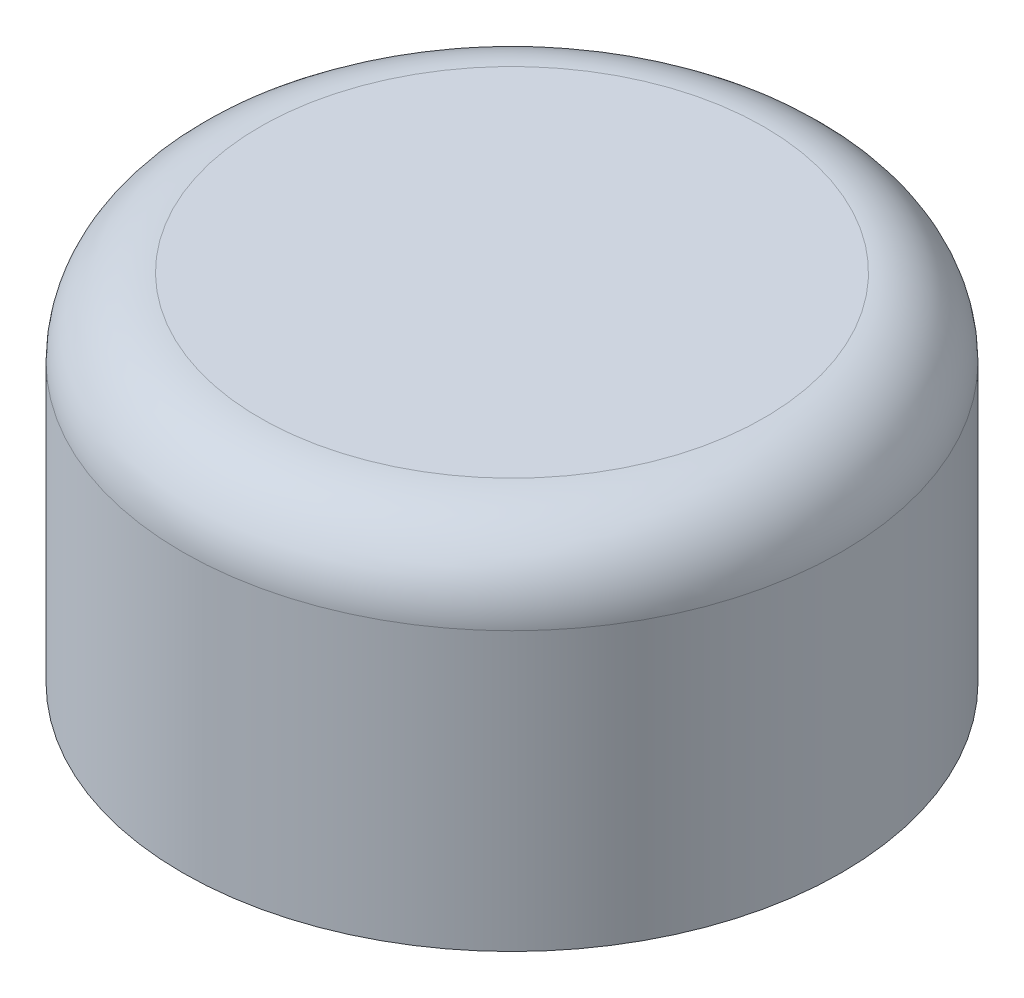
from build123d import *

# Parameters (mm, degrees)
SKETCH1_R           = 37.85
BOSS_EXTRUDE1_DEPTH = 19.4
SKETCH4_R           = 1.5
CUT_EXTRUDE1_DEPTH  = 1


with BuildPart() as part:
    # Sketch1 → Boss-Extrude1 (new body)
    with BuildSketch(Plane(origin=(0, 0, 0), x_dir=(1, 0, 0), z_dir=(0, 1, 0))):
        with Locations(Location((0, 0, 0), (0, 0, 270))):
            Circle(SKETCH1_R)
    extrude(amount=BOSS_EXTRUDE1_DEPTH)

    # Sketch3 → Revolve1 (revolve)
    with BuildSketch(Plane(origin=(0, 0, 0), x_dir=(0, 0, -1), z_dir=(1, 0, 0))):
        with BuildLine():
            Line((37.85, 19.4), (37.85, 30.8))
            Line((37.85, 30.8), (37.85, 31.91000006))
            ThreePointArc((37.85, 31.91000006), (35.246179285, 38.196179345), (28.96, 40.80000006))
            Line((28.96, 40.80000006), (0, 40.80000006))
            Line((0, 40.80000006), (0, 19.4))
            Line((0, 19.4), (37.85, 19.4))
        make_face()
    revolve(axis=Axis((0, 19.4, 0), (0, 1, 0)))

    # Sketch4 → Cut-Extrude1 (cut)
    with BuildSketch(Plane.XZ):
        with Locations(Location((20.859650045, 20.859650045, 0), (0, 0, 270))):
            Circle(SKETCH4_R)
        with Locations(Location((-20.859650045, 20.859650045, 0), (0, 0, 270))):
            Circle(SKETCH4_R)
        with Locations(Location((-20.859650045, -20.859650045, 0), (0, 0, 270))):
            Circle(SKETCH4_R)
        with Locations(Location((20.859650045, -20.859650045, 0), (0, 0, 270))):
            Circle(SKETCH4_R)
    extrude(amount=-CUT_EXTRUDE1_DEPTH, mode=Mode.SUBTRACT)


solid = part.part
